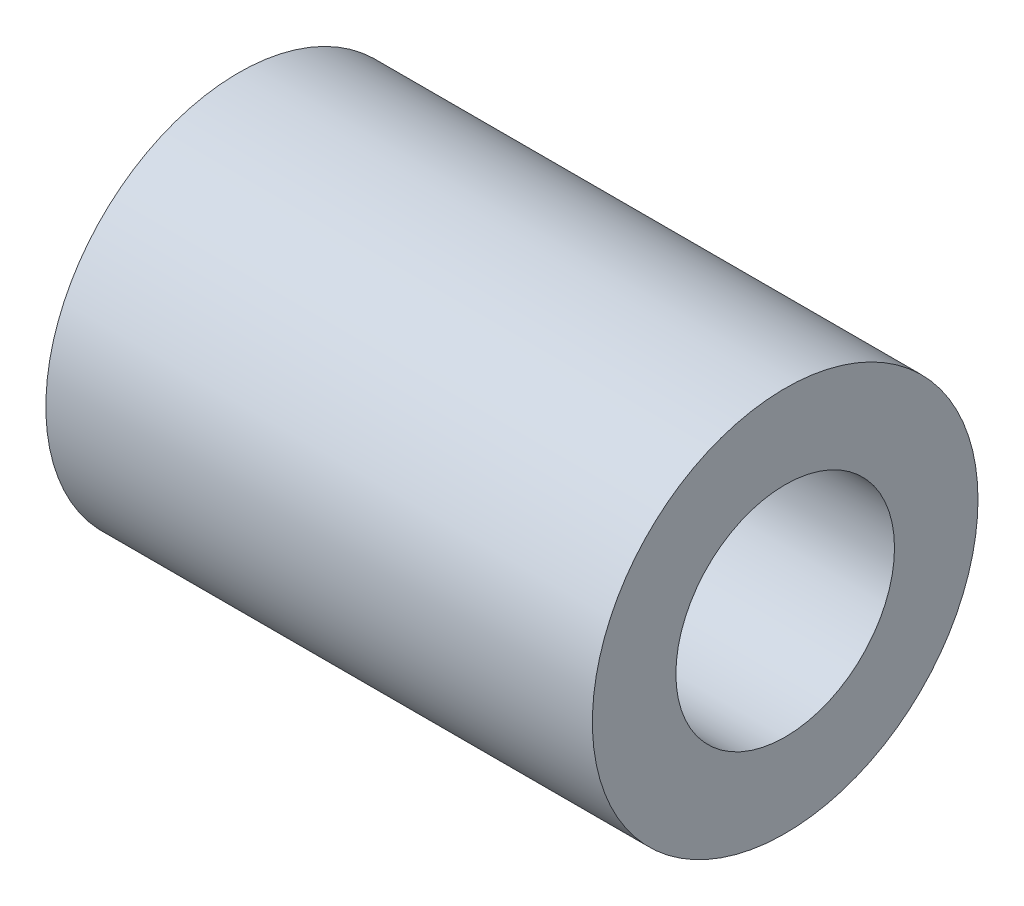
from build123d import *

# Parameters (mm, degrees)
SKETCH1_R           = 3.175
SKETCH1_R_2         = 1.8
BOSS_EXTRUDE1_DEPTH = 9


with BuildPart() as part:
    # Sketch1 → Boss-Extrude1 (new body)
    with BuildSketch(Plane(origin=(0, 0, 0), x_dir=(0, 0, -1), z_dir=(1, 0, 0))):
        Circle(SKETCH1_R)
        Circle(SKETCH1_R_2, mode=Mode.SUBTRACT)
    extrude(amount=BOSS_EXTRUDE1_DEPTH)


solid = part.part
